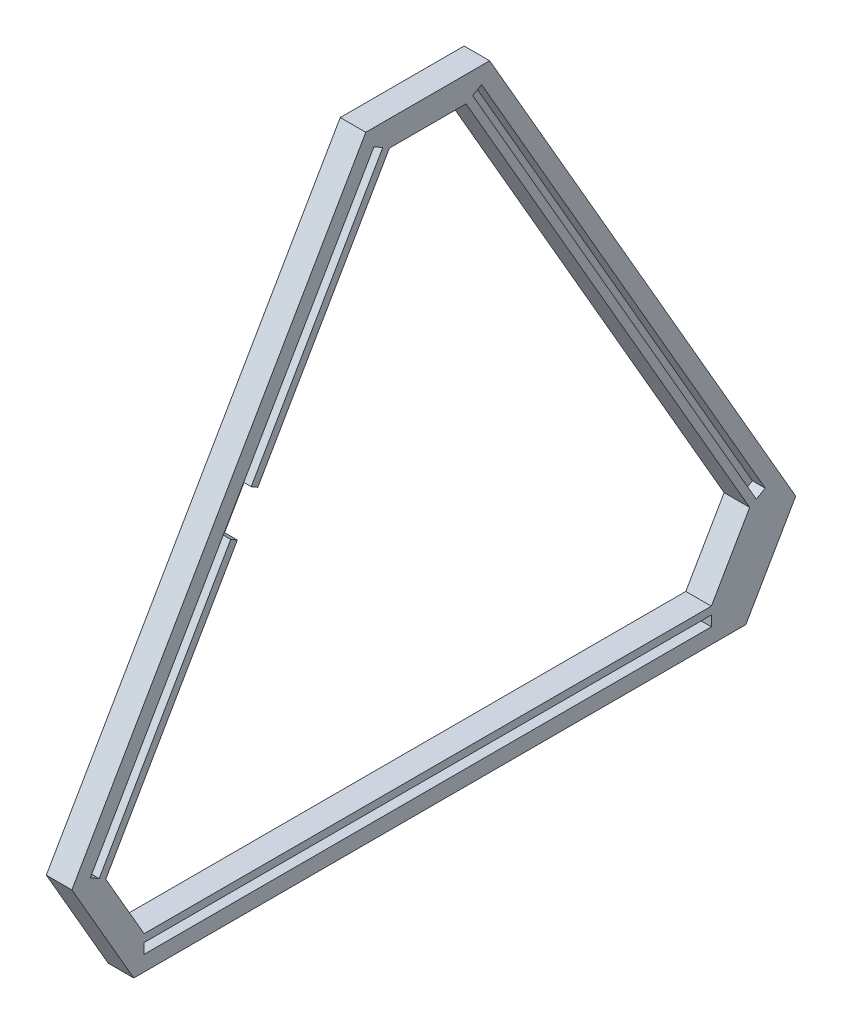
from build123d import *

# Parameters (mm, degrees)
BOSS_EXTRUDE1_DEPTH = 155
SKETCH4_W           = 144
SKETCH4_H           = 111
CUT_EXTRUDE1_DEPTH  = 5
SKETCH5_R           = 38.5
CUT_EXTRUDE2_DEPTH  = 10
BOSS_EXTRUDE2_DEPTH = 5
CUT_EXTRUDE3_DEPTH  = 5
SKETCH8_W           = 111
SKETCH8_H           = 2
CUT_EXTRUDE4_DEPTH  = 2.5
CUT_EXTRUDE5_DEPTH  = 2.5


with BuildPart() as part:
    # Sketch3 → Boss-Extrude1 (new body)
    with BuildSketch(Plane(origin=(0, 0, 0), x_dir=(0, 0, -1), z_dir=(1, 0, 0))):
        Polygon((58.381197846, 114.119200877), (0.860471904, 14.490381057), (12.979274058, -6.5), (132.75, -6.5), (142.504165125, 10.394709581), (82.618802154, 114.119200877), align=None)
        Polygon((7.5, 12.990381057), (15, 0), (15, -1.5), (126, -1.5), (126, 0), (133.5, 12.990381057), (134.799038106, 13.740381057), (79.299038106, 109.869200877), (78, 109.119200877), (63, 109.119200877), (61.700961894, 109.869200877), (6.200961894, 13.740381057), align=None, mode=Mode.SUBTRACT)
    extrude(amount=BOSS_EXTRUDE1_DEPTH)

    # Sketch4 → Cut-Extrude1 (cut)
    with BuildSketch(Plane(origin=(0, 3.25, 5.629165125), x_dir=(1, 0, 0), z_dir=(0, 0.4999999999999995, 0.8660254037844389))):
        with Locations((77.5, 70.5)):
            Rectangle(SKETCH4_W, SKETCH4_H)
    extrude(amount=-CUT_EXTRUDE1_DEPTH, mode=Mode.SUBTRACT)

    # Sketch5 → Cut-Extrude2 (cut)
    with BuildSketch(Plane(origin=(0, 64.304790967, -111.379165125), x_dir=(-1, 0, 0), z_dir=(0, 0.5000000000000006, -0.8660254037844385))):
        with Locations(Location((-77.5, -2.364637029, 0), (0, 0, 90))):
            Circle(SKETCH5_R)
    extrude(amount=-CUT_EXTRUDE2_DEPTH, mode=Mode.SUBTRACT)


with BuildPart() as body_2:
    # Sketch6 → Boss-Extrude2 (new body)
    with BuildSketch(Plane(origin=(155, 0, 0), x_dir=(0, 0, -1), z_dir=(1, 0, 0))):
        Polygon((82.618802154, 114.119200877), (58.381197846, 114.119200877), (0.860471904, 14.490381057), (12.979274058, -6.5), (132.75, -6.5), (142.504165125, 10.394709581), align=None)
    extrude(amount=BOSS_EXTRUDE2_DEPTH)

    # Sketch7 → Cut-Extrude3 (cut)
    with BuildSketch(Plane(origin=(160, 0, 0), x_dir=(0, 0, -1), z_dir=(1, 0, 0))):
        Polygon((63, 109.119200877), (7.5, 12.990381057), (15, 0), (126, 0), (133.5, 12.990381057), (78, 109.119200877), align=None)
    extrude(amount=-CUT_EXTRUDE3_DEPTH, mode=Mode.SUBTRACT)

    # Sketch8 → Cut-Extrude4 (cut)
    with BuildSketch(Plane(origin=(160, 0, 0), x_dir=(0, 0, -1), z_dir=(1, 0, 0))):
        Polygon((6.200961894, 13.740381057), (61.700961894, 109.869200877), (59.968911087, 110.869200877), (4.468911087, 14.740381057), align=None)
        with Locations((70.5, -2.5)):
            Rectangle(SKETCH8_W, SKETCH8_H)
        Polygon((79.299038106, 109.869200877), (134.799038106, 13.740381057), (136.531088913, 14.740381057), (81.031088913, 110.869200877), align=None)
    extrude(amount=-CUT_EXTRUDE4_DEPTH, mode=Mode.SUBTRACT)

    # Sketch10 → Cut-Extrude5 (cut)
    with BuildSketch(Plane(origin=(160, 0, 0), x_dir=(0, 0, -1), z_dir=(1, 0, 0))):
        Polygon((37.25, 64.518892582), (33.25, 57.590689352), (31.950961894, 58.340689352), (35.950961894, 65.268892582), align=None)
    extrude(amount=-CUT_EXTRUDE5_DEPTH, mode=Mode.SUBTRACT)


solid = body_2.part
